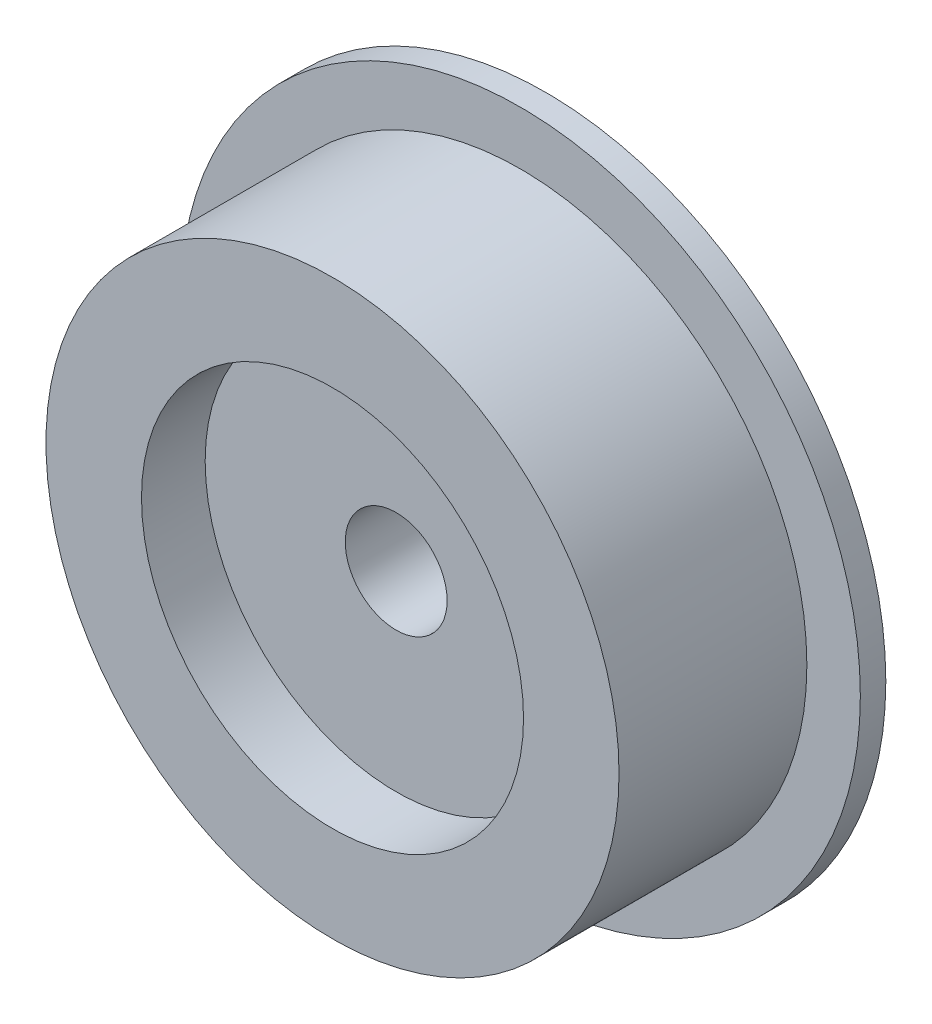
from build123d import *

# Parameters (mm, degrees)
SKETCH3_R               = 53.4
BOSS_EXTRUDE1_DEPTH     = 38.5
SKETCH4_R               = 8
CUT_EXTRUDE1_DEPTH      = 85.766561804
BOSS_EXTRUDE3_START     = 2
SKETCH6_R               = 16
SKETCH6_R_2             = 8
BOSS_EXTRUDE3_DEPTH     = 2
SKETCH8_R               = 2.5
CUT_EXTRUDE4_DEPTH      = 20
SKETCH9_R               = 53.4
SKETCH9_R_2             = 45
CUT_EXTRUDE5_DEPTH      = 34.5
CUT_EXTRUDE6_DEPTH      = 2
CUT_EXTRUDE6_DEPTH_BACK = 5
SKETCH10_R              = 50
SKETCH11_R              = 30
CUT_EXTRUDE7_DEPTH      = 10


with BuildPart() as part:
    # Sketch3 → Boss-Extrude1 (new body)
    with BuildSketch(Plane.XY):
        Circle(SKETCH3_R)
    extrude(amount=-BOSS_EXTRUDE1_DEPTH)

    # Sketch4 → Cut-Extrude1 (cut, through all)
    with BuildSketch(Plane.XY):
        Circle(SKETCH4_R)
    extrude(amount=-CUT_EXTRUDE1_DEPTH, mode=Mode.SUBTRACT)

    # Sketch6 → Boss-Extrude3 (add)
    with BuildSketch(Plane.XY.offset(BOSS_EXTRUDE3_START)):
        Circle(SKETCH6_R)
        Circle(SKETCH6_R_2, mode=Mode.SUBTRACT)
    extrude(amount=-BOSS_EXTRUDE3_DEPTH)

    # Sketch8 → Cut-Extrude4 (cut)
    with BuildSketch(Plane(origin=(0, 0, -38.5), x_dir=(-1, 0, 0), z_dir=(0, 0, -1))):
        with Locations((0, 30)):
            Circle(SKETCH8_R)
        with Locations((30, 0)):
            Circle(SKETCH8_R)
        with Locations((0, -30)):
            Circle(SKETCH8_R)
        with Locations((-30, 0)):
            Circle(SKETCH8_R)
    extrude(amount=-CUT_EXTRUDE4_DEPTH, mode=Mode.SUBTRACT)

    # Sketch9 → Cut-Extrude5 (cut)
    with BuildSketch(Plane.XY):
        Circle(SKETCH9_R)
        Circle(SKETCH9_R_2, mode=Mode.SUBTRACT)
    extrude(amount=-CUT_EXTRUDE5_DEPTH, mode=Mode.SUBTRACT)

    # Sketch10 → Cut-Extrude6 (cut, two sides: drawn at the far end of the back side and taken through both)
    with BuildSketch(Plane.XY.offset(-CUT_EXTRUDE6_DEPTH_BACK)):
        Circle(SKETCH10_R)
    extrude(amount=CUT_EXTRUDE6_DEPTH + CUT_EXTRUDE6_DEPTH_BACK, mode=Mode.SUBTRACT)

    # Sketch11 → Cut-Extrude7 (cut)
    with BuildSketch(Plane.XY.offset(-5)):
        Circle(SKETCH11_R)
    extrude(amount=-CUT_EXTRUDE7_DEPTH, mode=Mode.SUBTRACT)


solid = part.part
